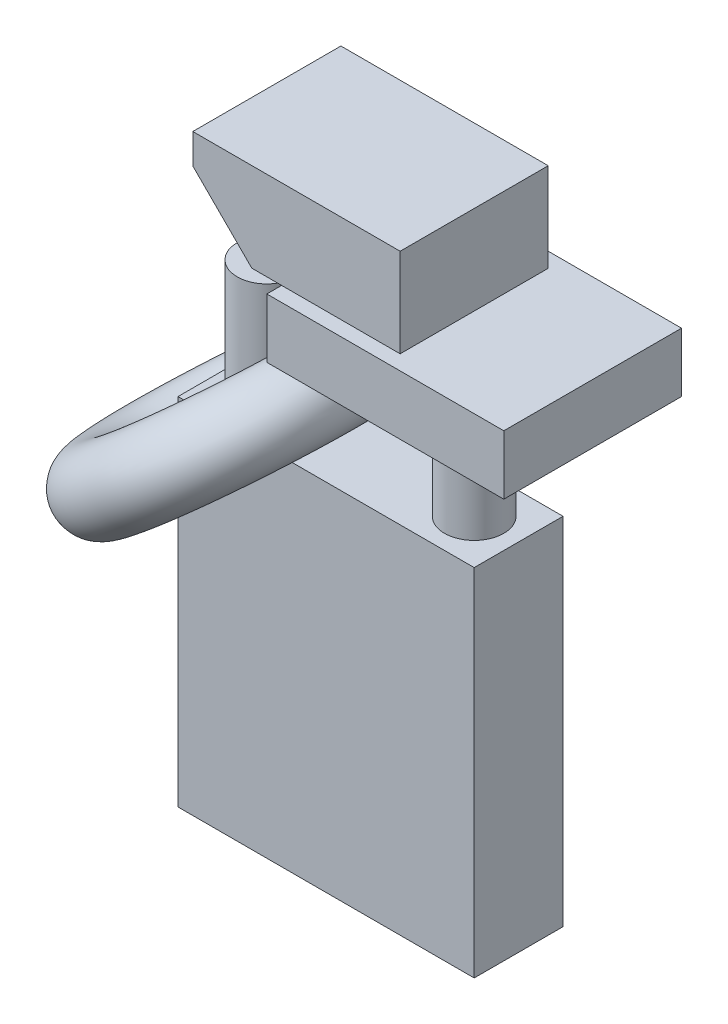
from build123d import *

# Parameters (mm, degrees)
SKETCH1_W           = 31.75
SKETCH1_H           = 38.1
BOSS_EXTRUDE1_DEPTH = 4.7625
SKETCH2_R           = 3.175
BOSS_EXTRUDE2_DEPTH = 12.7
SKETCH3_W           = 25.4
SKETCH3_H           = 6.35
BOSS_EXTRUDE3_DEPTH = 9.525
BOSS_EXTRUDE4_DEPTH = 7.9375
SKETCH5_R           = 3.96875


with BuildPart() as part:
    # Sketch1 → Boss-Extrude1 (new, symmetric)
    with BuildSketch(Plane.XY):
        with Locations((15.875, 19.05)):
            Rectangle(SKETCH1_W, SKETCH1_H)
    extrude(amount=BOSS_EXTRUDE1_DEPTH, both=True)

    # Sketch2 → Boss-Extrude2 (add, symmetric)
    with BuildSketch(Plane(origin=(0, 38.1, 0), x_dir=(1, 0, 0), z_dir=(0, 1, 0))):
        with Locations(Location((4.7625, 0, 0), (0, 0, 90))):
            Circle(SKETCH2_R)
        with Locations(Location((26.9875, 0, 0), (0, 0, 90))):
            Circle(SKETCH2_R)
    extrude(amount=BOSS_EXTRUDE2_DEPTH, both=True)

    # Sketch3 → Boss-Extrude3 (add, symmetric)
    with BuildSketch(Plane.XY):
        with Locations((26.9875, 53.975)):
            Rectangle(SKETCH3_W, SKETCH3_H)
    extrude(amount=BOSS_EXTRUDE3_DEPTH, both=True)

    # Sketch4 → Boss-Extrude4 (add, symmetric)
    with BuildSketch(Plane.XY):
        Polygon((26.9875, 57.15), (26.9875, 66.675), (4.7625, 66.675), (4.7625, 63.4746), (11.0871, 57.15), align=None)
    extrude(amount=BOSS_EXTRUDE4_DEPTH, both=True)


with BuildPart() as body_2:
    # Sketch5 → Revolve1 (revolve)
    with BuildSketch(Plane.XY, mode=Mode.PRIVATE) as revolve1_sk:
        with Locations((11.90625, 43.18)):
            Circle(SKETCH5_R)
    revolve(revolve1_sk.sketch.rotate(Axis((0, 38.1, 0), (0.6401843996644798, -0.768221279597376, 0)), 180), axis=Axis((0, 38.1, 0), (0.6401843996644798, -0.768221279597376, 0)))


solid = Compound([part.part, body_2.part])
